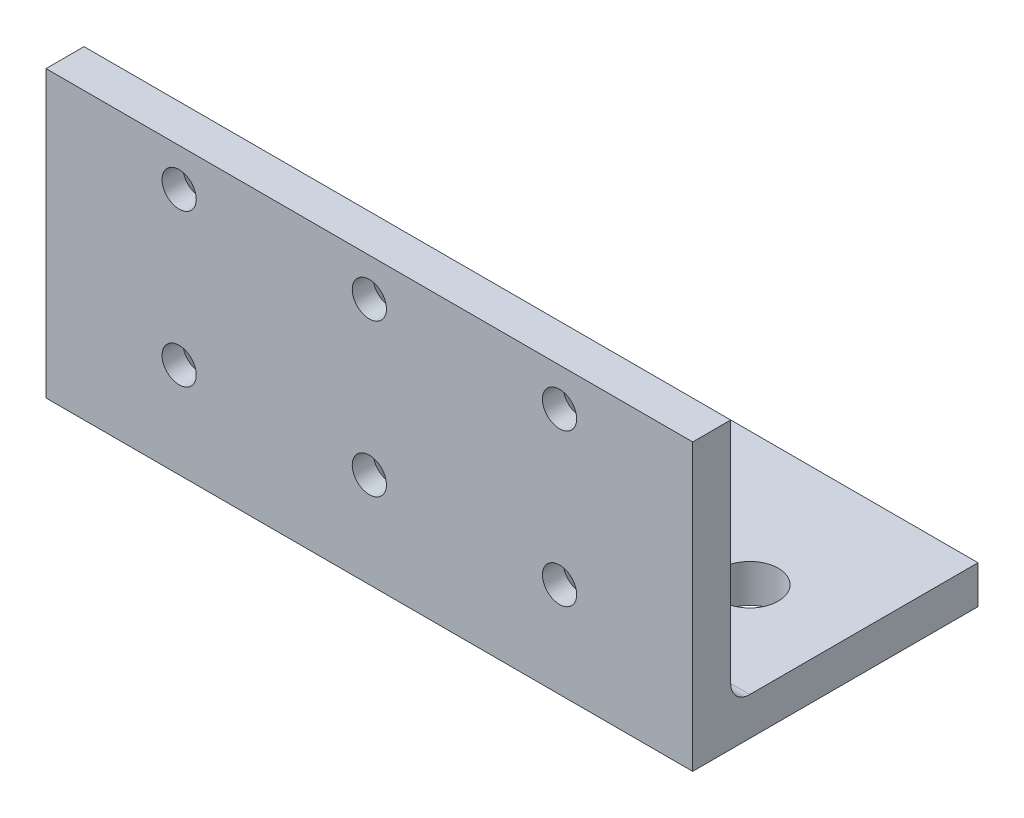
from build123d import *

# Parameters (mm, degrees)
BOSS_EXTRUDE1_DEPTH                          = 34
FILLET1_R                                    = 1
SKETCH2_R                                    = 1.5
CUT_EXTRUDE3_DEPTH                           = 10
CSK_FOR_M1_6_COUNTERSUNK_FLAT_HEAD_S_2_COUNT = 2
CSK_FOR_M1_6_COUNTERSUNK_FLAT_HEAD_S_2_PITCH = 8
LPATTERN1_COUNT                              = 2
LPATTERN1_PITCH                              = 10
LPATTERN2_COUNT                              = 2
LPATTERN2_PITCH                              = 10


with BuildPart() as part:
    # Sketch1 → Boss-Extrude1 (new body)
    with BuildSketch(Plane(origin=(0, 0, 0), x_dir=(0, 0, -1), z_dir=(1, 0, 0))):
        Polygon((0, 15), (0, 0), (15, 0), (15, 2), (2, 2), (2, 15), align=None)
    extrude(amount=BOSS_EXTRUDE1_DEPTH)

    # Fillet1
    fillet1_edges = [part.edges().sort_by_distance(p)[0] for p in [
        (17, 2, -2),
    ]]
    fillet(fillet1_edges, radius=FILLET1_R)

    # Sketch2 → Cut-Extrude3 (cut)
    with BuildSketch(Plane.XZ):
        with Locations(Location((28.999999992, -7.999999993, 0), (0, 0, 270))):
            Circle(SKETCH2_R)
        with Locations(Location((5, -8, 0), (0, 0, 270))):
            Circle(SKETCH2_R)
    extrude(amount=-CUT_EXTRUDE3_DEPTH, mode=Mode.SUBTRACT)

    # Sketch4 → CSK for M1.6 Countersunk Flat Head Screw1 (revolve, cut)
    with BuildSketch(Plane(origin=(17, 5, -2), x_dir=(0, 1, 0), z_dir=(1, 0, 0))):
        Polygon((0, 0), (0, 30.540774557), (0.9, 30), (0.9, 0.9), (1.8, 0), align=None)
    csk_for_m1_6_countersunk_flat_head_screw = revolve(axis=Axis((17, 5, -8.35), (0, 0, 1)), mode=Mode.SUBTRACT)

    # CSK for M1.6 Countersunk Flat Head S 2: CSK for M1.6 Countersunk Flat Head Screw1 ×2
    with Locations(*[(0, i * CSK_FOR_M1_6_COUNTERSUNK_FLAT_HEAD_S_2_PITCH, 0) for i in range(1, CSK_FOR_M1_6_COUNTERSUNK_FLAT_HEAD_S_2_COUNT)]):
        add(csk_for_m1_6_countersunk_flat_head_screw, mode=Mode.SUBTRACT)

    # LPattern1: CSK for M1.6 Countersunk Flat Head Screw1 ×2
    with Locations(*[(-i * LPATTERN1_PITCH, 0, 0) for i in range(1, LPATTERN1_COUNT)]):
        add(csk_for_m1_6_countersunk_flat_head_screw, mode=Mode.SUBTRACT)

    # LPattern1 copy 1 sketch → LPattern1 copy 1 (revolve, cut)
    with BuildSketch(Plane(origin=(7, 13, -2), x_dir=(0, 1, 0), z_dir=(1, 0, 0))):
        Polygon((0, 0), (0, 30.540774557), (0.9, 30), (0.9, 0.9), (1.8, 0), align=None)
    revolve(axis=Axis((7, 13, -8.35), (0, 0, 1)), mode=Mode.SUBTRACT)

    # LPattern2: CSK for M1.6 Countersunk Flat Head Screw1 ×2
    with Locations(*[(i * LPATTERN2_PITCH, 0, 0) for i in range(1, LPATTERN2_COUNT)]):
        add(csk_for_m1_6_countersunk_flat_head_screw, mode=Mode.SUBTRACT)

    # LPattern2 copy 1 sketch → LPattern2 copy 1 (revolve, cut)
    with BuildSketch(Plane(origin=(27, 13, -2), x_dir=(0, 1, 0), z_dir=(1, 0, 0))):
        Polygon((0, 0), (0, 30.540774557), (0.9, 30), (0.9, 0.9), (1.8, 0), align=None)
    revolve(axis=Axis((27, 13, -8.35), (0, 0, 1)), mode=Mode.SUBTRACT)


solid = part.part
